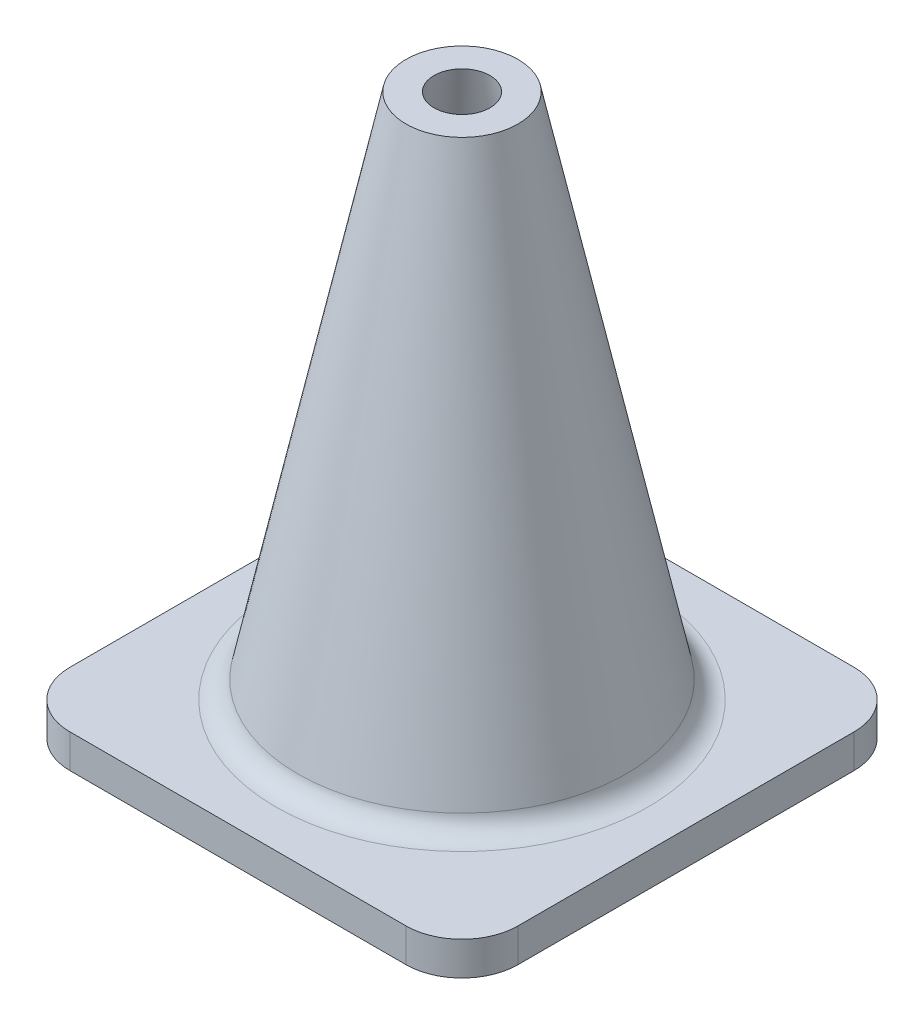
from build123d import *

# Parameters (mm, degrees)
SKETCH2_W           = 40
SKETCH2_H           = 40
BOSS_EXTRUDE1_DEPTH = 3
FILLET1_R           = 5
CUT_EXTRUDE1_REACH  = 59.446
SKETCH4_R           = 12.5
FILLET2_R           = 5
FILLET3_R           = 2
FILLET4_R           = 0.5


with BuildPart() as part:
    # Sketch2 → Boss-Extrude1 (new body)
    with BuildSketch(Plane(origin=(0, 0, 0), x_dir=(1, 0, 0), z_dir=(0, 1, 0))):
        Rectangle(SKETCH2_W, SKETCH2_H)
    extrude(amount=BOSS_EXTRUDE1_DEPTH)

    # Sketch3 → Revolve1 (revolve)
    with BuildSketch(Plane.XY, mode=Mode.PRIVATE) as revolve1_sk:
        Polygon((-15, 3), (-5, 50), (-2.5, 50), (-12.5, 3), align=None)
    revolve(revolve1_sk.sketch.rotate(Axis((0, -2.5, 0), (0, 1, 0)), 270), axis=Axis((0, -2.5, 0), (0, 1, 0)))

    # Fillet1
    fillet1_edges = [part.edges().sort_by_distance(p)[0] for p in [
        (20, 1.5, 20),
        (-20, 1.5, 20),
        (-20, 1.5, -20),
        (20, 1.5, -20),
    ]]
    fillet(fillet1_edges, radius=FILLET1_R)

    # Sketch4 → Cut-Extrude1 (cut, up to next)
    with BuildSketch(Plane.XZ, mode=Mode.PRIVATE) as cut_extrude1_sk1:
        with Locations(Location((0, 0, 0), (0, 0, 270))):
            Circle(SKETCH4_R)
    cut_extrude1_tool1 = extrude(cut_extrude1_sk1.sketch, amount=-CUT_EXTRUDE1_REACH, mode=Mode.PRIVATE) & part.part
    add(cut_extrude1_tool1.solids().sort_by_distance((0, 0, 0))[0], mode=Mode.SUBTRACT)

    # Fillet2
    fillet2_edges = [part.edges().sort_by_distance(p)[0] for p in [
        (0, 3, 12.5),
    ]]
    fillet(fillet2_edges, radius=FILLET2_R)

    # Fillet3
    fillet3_edges = [part.edges().sort_by_distance(p)[0] for p in [
        (0, 3, 15),
    ]]
    fillet(fillet3_edges, radius=FILLET3_R)

    # Fillet4
    fillet4_edges = [part.edges().sort_by_distance(p)[0] for p in [
        (0, 0, 12.5),
    ]]
    fillet(fillet4_edges, radius=FILLET4_R)


solid = part.part
